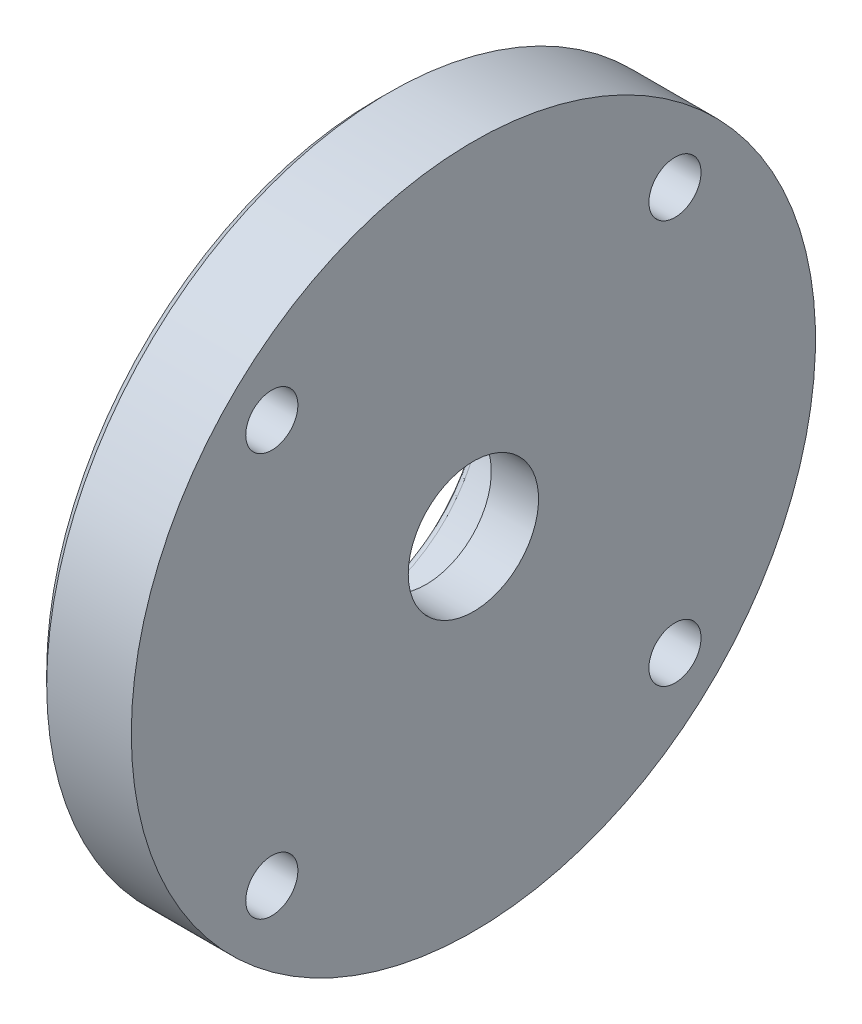
from build123d import *

# Parameters (mm, degrees)
SKETCH2_R           = 8
BOSS_EXTRUDE1_DEPTH = 2
FILLET1_R           = 0.5
SKETCH3_R           = 1.6
CUT_EXTRUDE1_DEPTH  = 10
SKETCH4_R           = 4
CUT_EXTRUDE2_DEPTH  = 10
CUT_EXTRUDE3_START  = -3
SKETCH5_R           = 8
CUT_EXTRUDE3_DEPTH  = 3


with BuildPart() as part:
    # Sketch1 → Revolve1 (revolve)
    with BuildSketch(Plane.XY, mode=Mode.PRIVATE) as revolve1_sk:
        Polygon((0, 0), (0, 20.292893219), (0.707106781, 21), (5.9, 21), (5.9, 0), align=None)
    revolve(revolve1_sk.sketch.rotate(Axis((0, 0, 0), (1, 0, 0)), 90), axis=Axis((0, 0, 0), (1, 0, 0)))

    # Sketch2 → Boss-Extrude1 (add)
    with BuildSketch(Plane.ZY):
        with BuildLine():
            Line((-11.5, -4.898979486), (-11.5, 4.898979486))
            ThreePointArc((-11.5, 4.898979486), (0, 12.5), (11.5, 4.898979486))
            Line((11.5, 4.898979486), (11.5, -4.898979486))
            ThreePointArc((11.5, -4.898979486), (0, -12.5), (-11.5, -4.898979486))
        make_face()
        Circle(SKETCH2_R, mode=Mode.SUBTRACT)
    extrude(amount=BOSS_EXTRUDE1_DEPTH)

    # Fillet1
    fillet1_edges = [part.edges().sort_by_distance(p)[0] for p in [
        (-2, 12.5, 0),
        (-2, 0, -11.5),
        (-2, -12.5, 0),
        (-2, 0, 11.5),
        (0, 12.5, 0),
        (-1, 4.898979486, 11.5),
        (0, 0, -11.5),
        (-1, 4.898979486, -11.5),
        (0, -12.5, 0),
        (-1, -4.898979486, -11.5),
        (0, 0, 11.5),
        (-1, -4.898979486, 11.5),
        (-2, 0, -8),
    ]]
    fillet(fillet1_edges, radius=FILLET1_R)

    # Sketch3 → Cut-Extrude1 (cut)
    with BuildSketch(Plane.ZY):
        with Locations((12.374368671, 12.374368671)):
            Circle(SKETCH3_R)
        with Locations((-12.374368671, 12.374368671)):
            Circle(SKETCH3_R)
        with Locations((-12.374368671, -12.374368671)):
            Circle(SKETCH3_R)
        with Locations((12.374368671, -12.374368671)):
            Circle(SKETCH3_R)
    extrude(amount=-CUT_EXTRUDE1_DEPTH, mode=Mode.SUBTRACT)

    # Sketch4 → Cut-Extrude2 (cut)
    with BuildSketch(Plane.ZY):
        Circle(SKETCH4_R)
    extrude(amount=-CUT_EXTRUDE2_DEPTH, mode=Mode.SUBTRACT)

    # Sketch5 → Cut-Extrude3 (cut)
    with BuildSketch(Plane.ZY.offset(CUT_EXTRUDE3_START)):
        Circle(SKETCH5_R)
    extrude(amount=CUT_EXTRUDE3_DEPTH, mode=Mode.SUBTRACT)


solid = part.part
